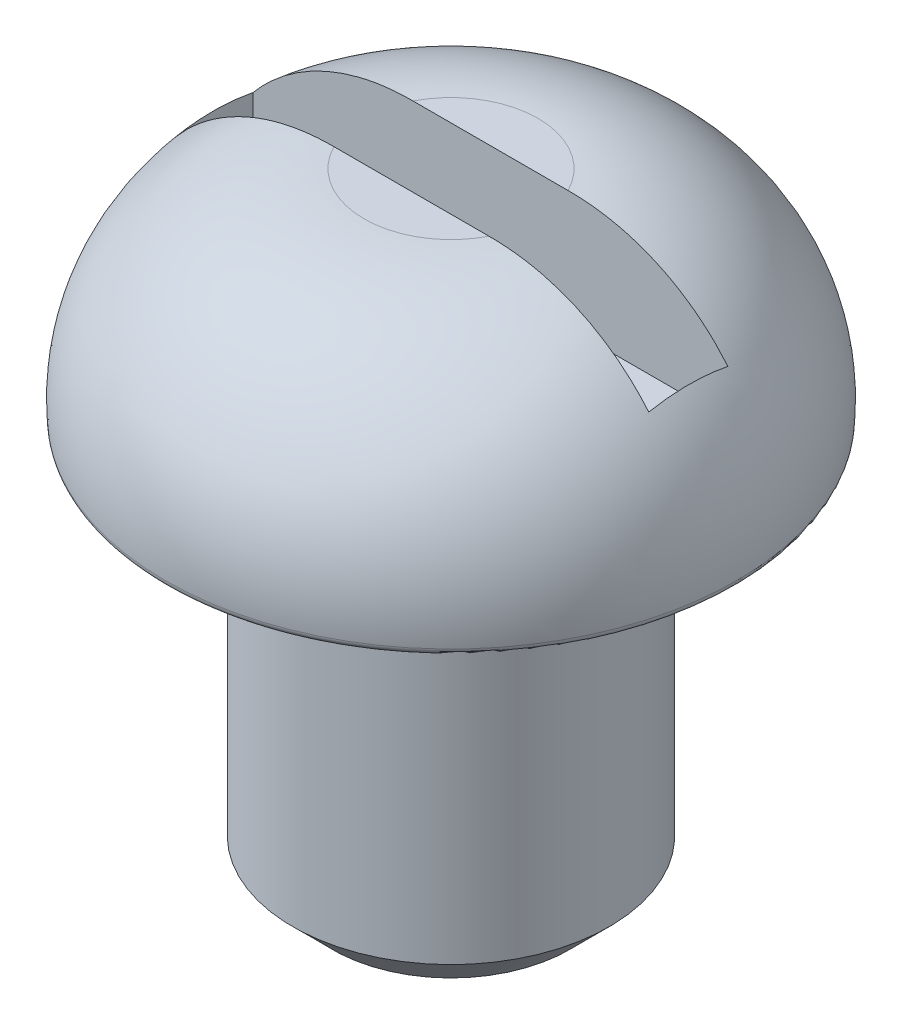
from build123d import *

# Parameters (mm, degrees)
FILLET_1_R          = 0.1
SKETCH_3_W          = 6
SKETCH_3_H          = 1
CUT_EXTRUDE_2_DEPTH = 1.5


with BuildPart() as part:
    # Эскиз1 → Повернуть1 (revolve)
    with BuildSketch(Plane.XY):
        with BuildLine():
            Line((3.6, 5), (2, 5))
            Line((2, 5), (2, 0.5))
            Line((2, 0.5), (1.5, 0))
            Line((1.5, 0), (0, 0))
            Line((0, 0), (0, 7.8))
            Line((0, 7.8), (1.1, 7.8))
            ThreePointArc((1.1, 7.8), (2.976832438, 6.95967182), (3.6, 5))
        make_face()
    revolve(axis=Axis((0, 0, 0), (0, 1, 0)))

    # Скругление1
    fillet_1_edges = [part.edges().sort_by_distance(p)[0] for p in [
        (-3.6, 5, 0),
    ]]
    fillet(fillet_1_edges, radius=FILLET_1_R)

    # Эскиз3 → Вырез-Вытянуть2 (cut)
    with BuildSketch(Plane(origin=(0, 7.8, 0), x_dir=(-1, 0, 0), z_dir=(0, 1, 0))):
        Rectangle(SKETCH_3_W, SKETCH_3_H)
    extrude(amount=-CUT_EXTRUDE_2_DEPTH, mode=Mode.SUBTRACT)


solid = part.part
